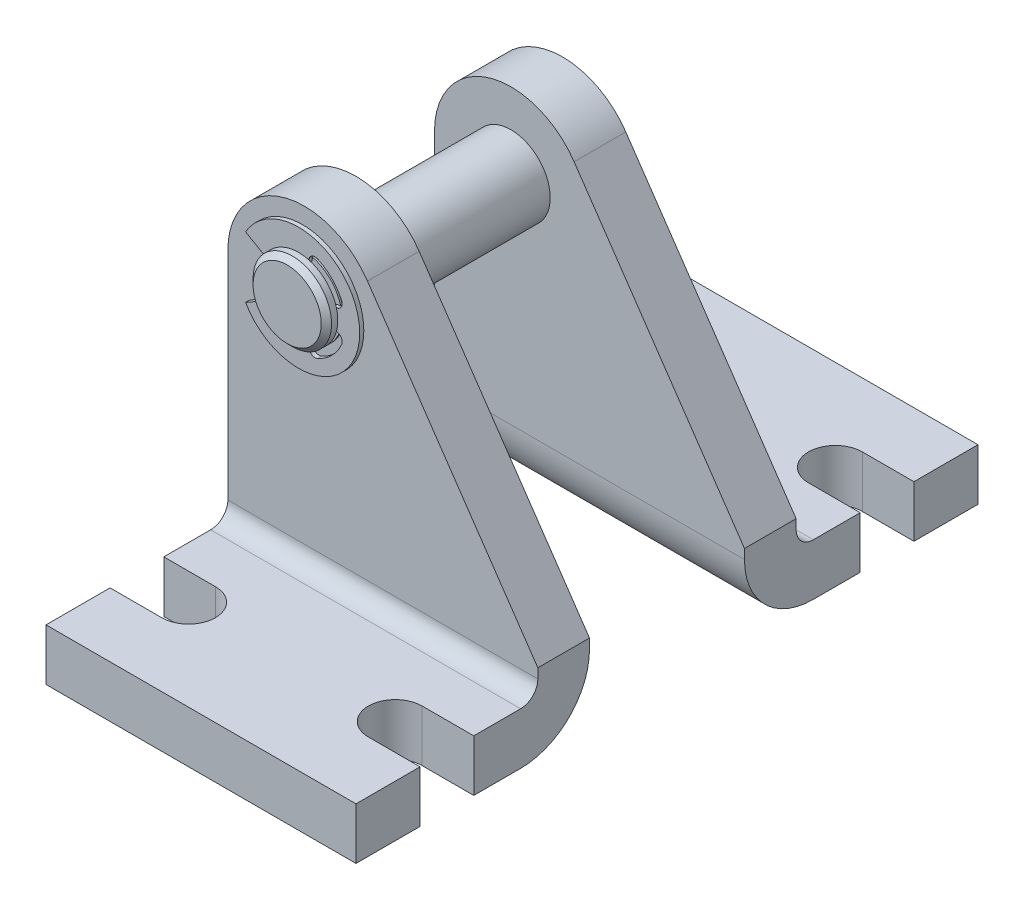
from build123d import *

# Parameters (mm, degrees)
SKETCH3_R           = 4.826
BOSS_EXTRUDE1_DEPTH = 6.35
SKETCH4_W           = 38.1
SKETCH4_H           = 6.35
BOSS_EXTRUDE2_DEPTH = 22.352
CUT_EXTRUDE1_DEPTH  = 56.67063506
FILLET1_R           = 2.116666667
FILLET2_R           = 8.466666667
BOSS_EXTRUDE3_DEPTH = 0.508


with BuildPart() as part:
    # Sketch3 → Boss-Extrude1 (new body)
    with BuildSketch(Plane.XY):
        with BuildLine():
            Line((-9.398, 0), (-9.398, -35.052))
            Line((-9.398, -35.052), (28.702, -35.052))
            Line((28.702, -35.052), (28.702, -25.4))
            Line((28.702, -25.4), (7.763798393, 5.295832184))
            ThreePointArc((7.763798393, 5.295832184), (-2.771121317, 8.980160948), (-9.398, 0))
        make_face()
        Circle(SKETCH3_R, mode=Mode.SUBTRACT)
    extrude(amount=BOSS_EXTRUDE1_DEPTH)

    # Sketch4 → Boss-Extrude2 (add)
    with BuildSketch(Plane.XY.offset(6.35)):
        with Locations((9.652, -31.877)):
            Rectangle(SKETCH4_W, SKETCH4_H)
    extrude(amount=BOSS_EXTRUDE2_DEPTH)

    # Sketch5 → Cut-Extrude1 (cut, through all)
    with BuildSketch(Plane(origin=(0, -28.702, 0), x_dir=(1, 0, 0), z_dir=(0, 1, 0))):
        with BuildLine():
            Line((-3.048, -20.828), (-9.398, -20.828))
            Line((-9.398, -20.828), (-9.398, -14.224))
            Line((-9.398, -14.224), (-3.048, -14.224))
            ThreePointArc((-3.048, -14.224), (0.254, -17.526), (-3.048, -20.828))
        make_face()
        with BuildLine():
            Line((22.352, -14.224), (28.702, -14.224))
            Line((28.702, -14.224), (28.702, -20.828))
            Line((28.702, -20.828), (22.352, -20.828))
            ThreePointArc((22.352, -20.828), (19.05, -17.526), (22.352, -14.224))
        make_face()
    extrude(amount=-CUT_EXTRUDE1_DEPTH, mode=Mode.SUBTRACT)

    # Fillet1
    fillet1_edges = [part.edges().sort_by_distance(p)[0] for p in [
        (9.652, -28.702, 6.35),
    ]]
    fillet(fillet1_edges, radius=FILLET1_R)

    # Fillet2
    fillet2_edges = [part.edges().sort_by_distance(p)[0] for p in [
        (9.652, -35.052, 0),
    ]]
    fillet(fillet2_edges, radius=FILLET2_R)


with BuildPart() as body_2:
    # Mirror2: mirrored copy
    add(part.part.mirror(Plane.XY.offset(-9.525)))


with BuildPart() as part_1:
    add(part.part)

    add(body_2.part)  # Revolve1 merges body 2
    # Sketch6 → Revolve1 (revolve)
    with BuildSketch(Plane(origin=(0, 0, 0), x_dir=(0, 0, -1), z_dir=(1, 0, 0)), mode=Mode.PRIVATE) as revolve1_sk:
        Polygon((-8.4582, 0), (27.5082, 0), (27.5082, 4.191), (26.8732, 4.826), (26.1112, 4.826), (26.1112, 4.064), (25.6032, 4.064), (25.6032, 4.826), (-6.5532, 4.826), (-6.5532, 4.064), (-7.0612, 4.064), (-7.0612, 4.826), (-7.8232, 4.826), (-8.4582, 4.191), align=None)
    revolve(revolve1_sk.sketch.rotate(Axis((0, 0, 8.4582), (0, 0, -1)), 180), axis=Axis((0, 0, 8.4582), (0, 0, -1)))

    # Sketch7 → Boss-Extrude3 (add)
    with BuildSketch(Plane(origin=(0, 0, -25.6032), x_dir=(-1, 0, 0), z_dir=(0, 0, -1))):
        with BuildLine():
            Line((3.519527241, 2.032), (6.511125396, 3.7592))
            ThreePointArc((6.511125396, 3.7592), (-7.5184, 0), (6.511125396, -3.7592))
            Line((6.511125396, -3.7592), (3.519527241, -2.032))
            ThreePointArc((3.519527241, -2.032), (1.555225469, -3.75464642), (-1.051840599, -3.925522558))
            Line((-1.051840599, -3.925522558), (-1.286625076, -4.801750155))
            ThreePointArc((-1.286625076, -4.801750155), (-1.692900021, -5.291481271), (-2.329124277, -5.30218611))
            ThreePointArc((-2.329124277, -5.30218611), (-4.094996791, -4.094996791), (-5.30218611, -2.329124277))
            ThreePointArc((-5.30218611, -2.329124277), (-5.291481271, -1.692900021), (-4.801750155, -1.286625076))
            Line((-4.801750155, -1.286625076), (-3.925522558, -1.051840599))
            ThreePointArc((-3.925522558, -1.051840599), (-4.064, 0), (-3.925522558, 1.051840599))
            Line((-3.925522558, 1.051840599), (-4.801750155, 1.286625076))
            ThreePointArc((-4.801750155, 1.286625076), (-5.291481271, 1.692900021), (-5.30218611, 2.329124277))
            ThreePointArc((-5.30218611, 2.329124277), (-4.094996791, 4.094996791), (-2.329124277, 5.30218611))
            ThreePointArc((-2.329124277, 5.30218611), (-1.692900021, 5.291481271), (-1.286625076, 4.801750155))
            Line((-1.286625076, 4.801750155), (-1.051840599, 3.925522558))
            ThreePointArc((-1.051840599, 3.925522558), (1.555225469, 3.75464642), (3.519527241, 2.032))
        make_face()
    boss_extrude3 = extrude(amount=BOSS_EXTRUDE3_DEPTH)

    # Mirror3: Boss-Extrude3 across plane
    add(boss_extrude3.mirror(Plane.XY.offset(-9.525)))


solid = part_1.part
